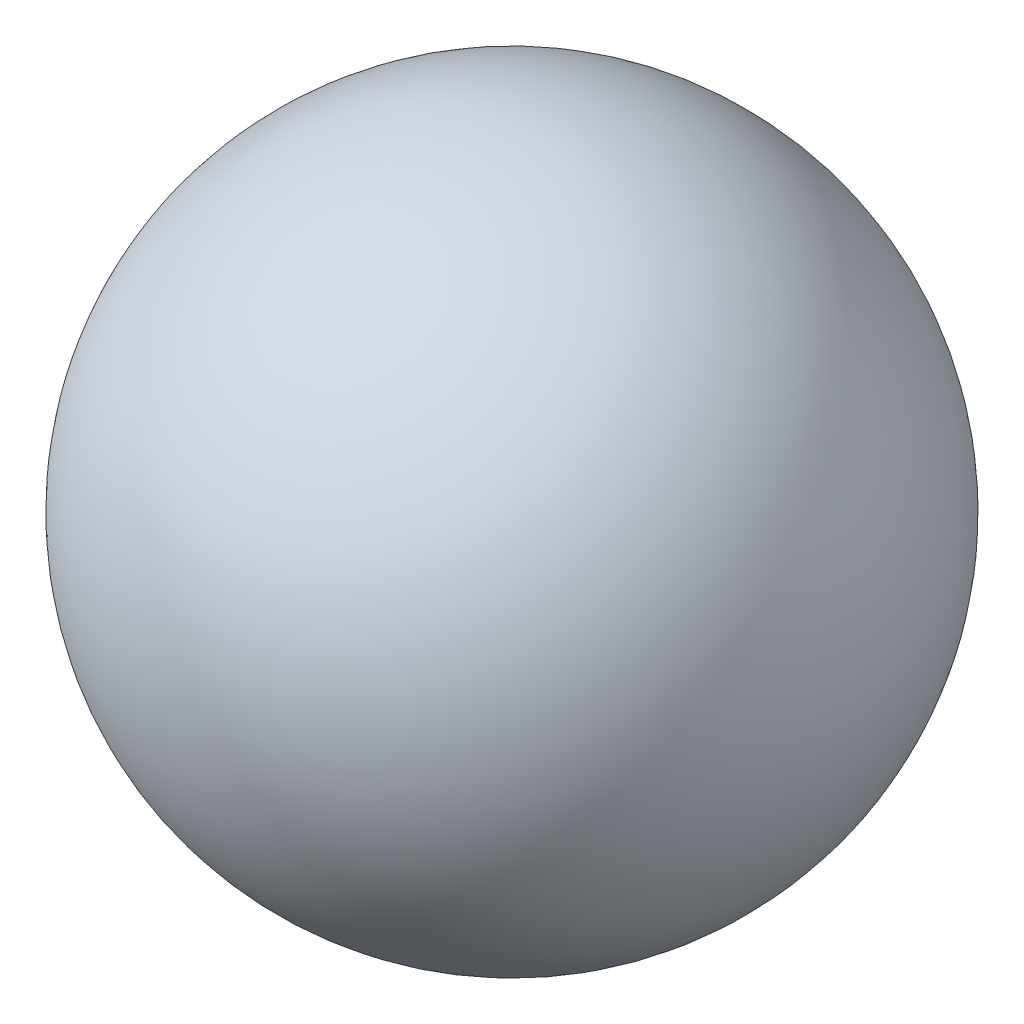
from build123d import *


with BuildPart() as part:
    # Sketch1 → Revolve1 (revolve)
    with BuildSketch(Plane.XY):
        with BuildLine():
            Line((-19.5, 0), (19.5, 0))
            ThreePointArc((19.5, 0), (0, 19.5), (-19.5, 0))
        make_face()
    revolve(axis=Axis((-19.5, 0, 0), (1, 0, 0)))


solid = part.part
